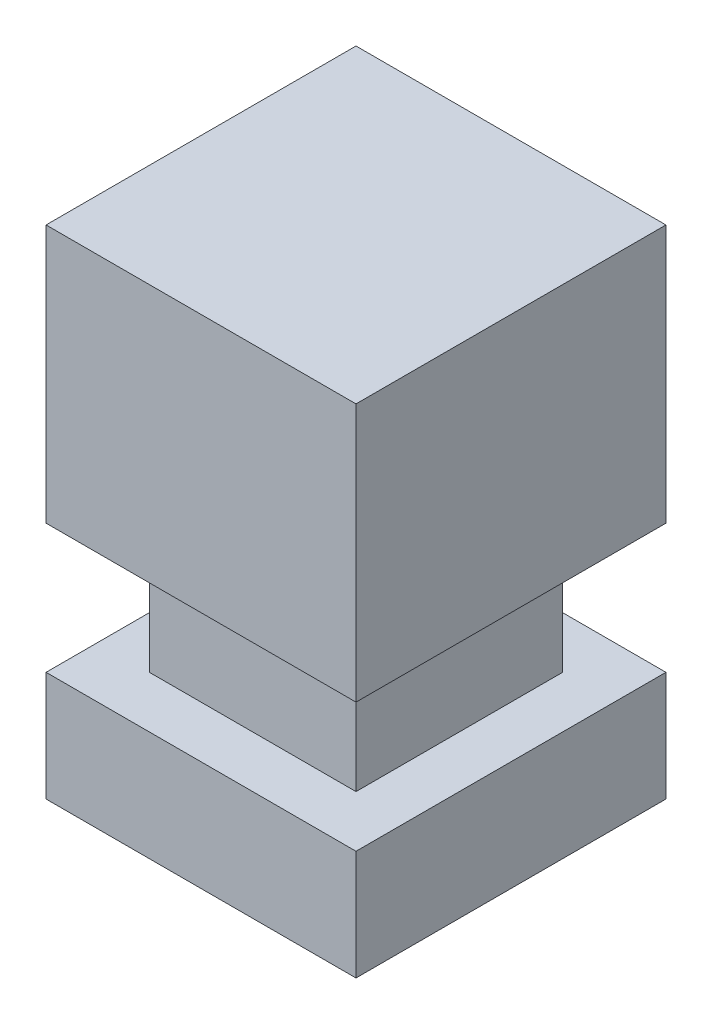
from build123d import *

# Parameters (mm, degrees)
SKETCH3_W           = 2.4
SKETCH3_H           = 2.4
BOSS_EXTRUDE3_DEPTH = 3.85
SKETCH8_W           = 0.4
SKETCH8_H           = 1
CUT_EXTRUDE1_DEPTH  = 2.4
SKETCH10_W          = 0.4
SKETCH10_H          = 1
CUT_EXTRUDE2_DEPTH  = 2.4


with BuildPart() as part:
    # Sketch3 → Boss-Extrude3 (new body)
    with BuildSketch(Plane(origin=(0, 0, 0), x_dir=(1, 0, 0), z_dir=(0, 1, 0))):
        Rectangle(SKETCH3_W, SKETCH3_H)
    extrude(amount=-BOSS_EXTRUDE3_DEPTH)

    # Sketch8 → Cut-Extrude1 (cut)
    with BuildSketch(Plane.XY.offset(1.2)):
        with Locations((-1, -2.5)):
            Rectangle(SKETCH8_W, SKETCH8_H)
        with Locations((1, -2.5)):
            Rectangle(SKETCH8_W, SKETCH8_H)
    extrude(amount=-CUT_EXTRUDE1_DEPTH, mode=Mode.SUBTRACT)

    # Sketch10 → Cut-Extrude2 (cut)
    with BuildSketch(Plane.ZY.offset(-1.2)):
        with Locations((-1, -2.5)):
            Rectangle(SKETCH10_W, SKETCH10_H)
        with Locations((1, -2.5)):
            Rectangle(SKETCH10_W, SKETCH10_H)
    extrude(amount=CUT_EXTRUDE2_DEPTH, mode=Mode.SUBTRACT)


solid = part.part
